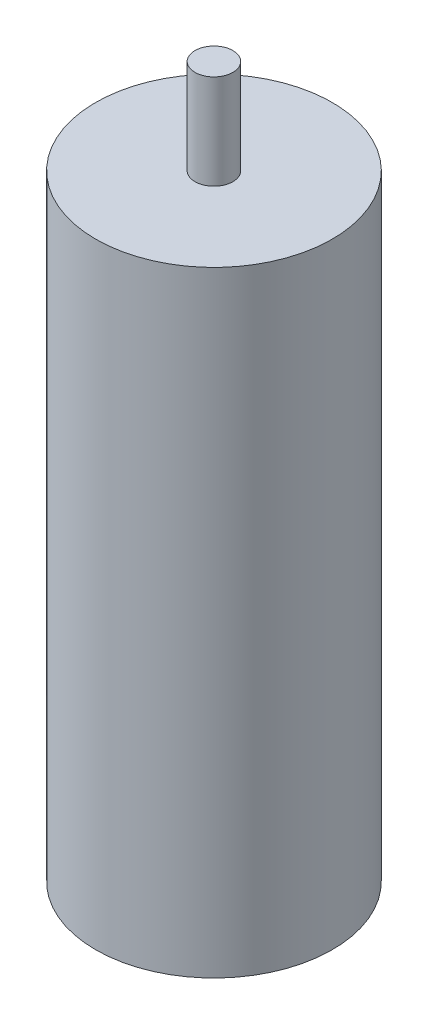
from build123d import *

# Parameters (mm, degrees)
CROQUIS1_R              = 12.5
SALIENTE_EXTRUIR1_DEPTH = 65
CROQUIS2_R              = 2
SALIENTE_EXTRUIR2_DEPTH = 10


with BuildPart() as part:
    # Croquis1 → Saliente-Extruir1 (new body)
    with BuildSketch(Plane(origin=(0, 0, 0), x_dir=(-1, 0, 0), z_dir=(0, 1, 0))):
        with Locations(Location((0, 0, 0), (0, 0, 90))):
            Circle(CROQUIS1_R)
    extrude(amount=SALIENTE_EXTRUIR1_DEPTH)

    # Croquis2 → Saliente-Extruir2 (add)
    with BuildSketch(Plane(origin=(0, 65, 0), x_dir=(-1, 0, 0), z_dir=(0, 1, 0))):
        with Locations(Location((0, 0, 0), (0, 0, 90))):
            Circle(CROQUIS2_R)
    extrude(amount=SALIENTE_EXTRUIR2_DEPTH)


solid = part.part
